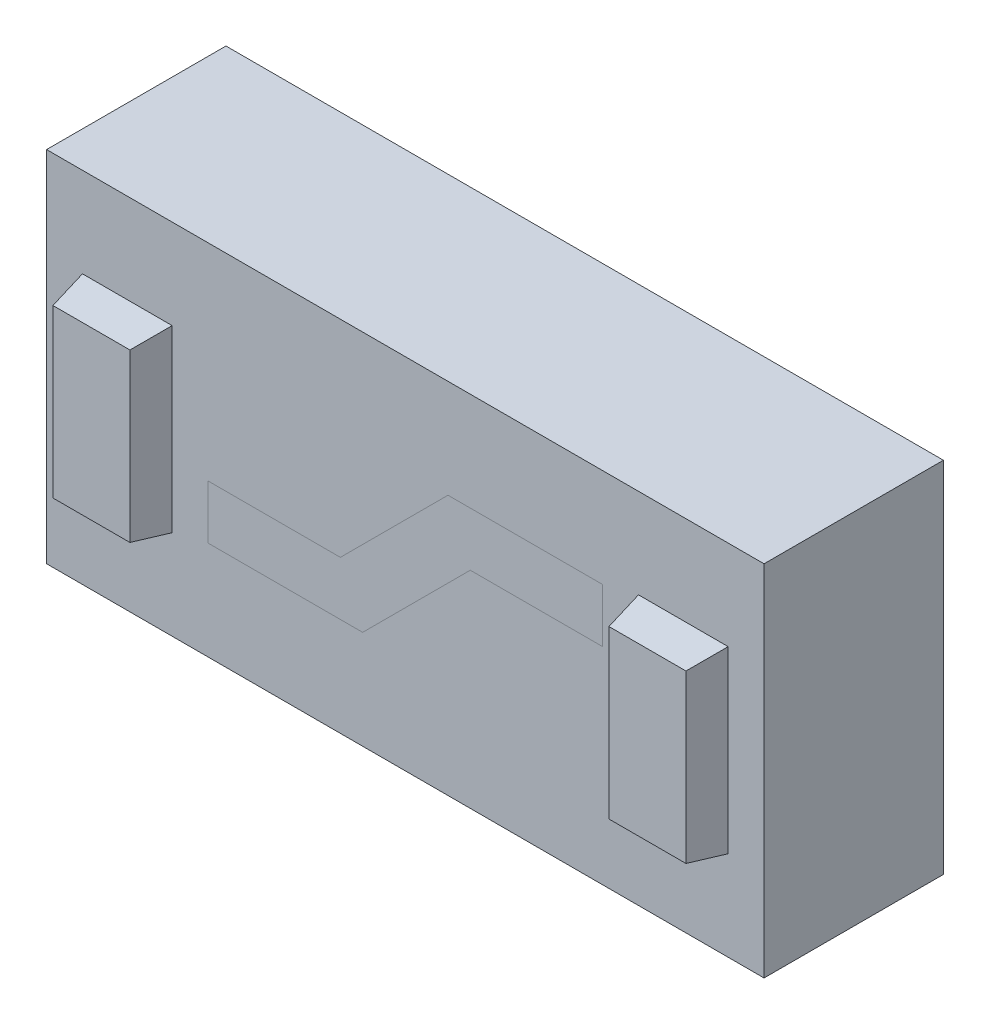
from build123d import *

# Parameters (mm, degrees)
SKETCH1_W                     = 40
SKETCH1_H                     = 20
BOSS_EXTRUDE1_DEPTH           = 10
CUT_EXTRUDE1_DEPTH            = 1.2
BOSS_EXTRUDE2_DEPTH           = 1.2
SKETCH3_W                     = 5
SKETCH3_H                     = 10
BOSS_EXTRUDE3_DEPTH           = 2
BOSS_EXTRUDE3_DRAFT           = 10
BOSS_EXTRUDE3_PROFILE_2_DEPTH = 2
BOSS_EXTRUDE3_PROFILE_2_DRAFT = 10


with BuildPart() as part:
    # Sketch1 → Boss-Extrude1 (new body)
    with BuildSketch(Plane.XY):
        Rectangle(SKETCH1_W, SKETCH1_H)
    extrude(amount=BOSS_EXTRUDE1_DEPTH)

    # Sketch2 → Cut-Extrude1 (cut)
    with BuildSketch(Plane.XY.offset(10)):
        Polygon((-3.621320344, -1.5), (2.378679656, 4.5), (11, 4.5), (11, 1.5), (3.621320344, 1.5), (-2.378679656, -4.5), (-11, -4.5), (-11, -1.5), align=None)
    extrude(amount=-CUT_EXTRUDE1_DEPTH, mode=Mode.SUBTRACT)


with BuildPart() as body_2:
    # Sketch2<2> → Boss-Extrude2 (new body)
    with BuildSketch(Plane.XY.offset(10)):
        Polygon((-3.621320344, -1.5), (2.378679656, 4.5), (11, 4.5), (11, 1.5), (3.621320344, 1.5), (-2.378679656, -4.5), (-11, -4.5), (-11, -1.5), align=None)
    extrude(amount=-BOSS_EXTRUDE2_DEPTH)


with BuildPart() as body_3:
    # Sketch3 → Boss-Extrude3 (with draft: the straight prism first)
    with BuildSketch(Plane.XY.offset(10)):
        with Locations((-15.5, 0)):
            Rectangle(SKETCH3_W, SKETCH3_H)
    extrude(amount=BOSS_EXTRUDE3_DEPTH)
    # Boss-Extrude3: the draft: its side faces are tilted about the plane it starts from
    boss_extrude3_sides = [body_3.faces().sort_by_distance(p)[0] for p in [
        (-15.5, -5, 11),
        (-13, 0, 11),
        (-15.5, 5, 11),
        (-18, 0, 11),
    ]]
    draft(boss_extrude3_sides, Plane.XY.offset(10), BOSS_EXTRUDE3_DRAFT)


with BuildPart() as body_4:
    # Sketch3 → Boss-Extrude3 profile 2 (with draft: the straight prism first)
    with BuildSketch(Plane.XY.offset(10)):
        with Locations((15.5, 0)):
            Rectangle(SKETCH3_W, SKETCH3_H)
    extrude(amount=BOSS_EXTRUDE3_PROFILE_2_DEPTH)
    # Boss-Extrude3 profile 2: the draft: its side faces are tilted about the plane it starts from
    boss_extrude3_profile_2_sides = [body_4.faces().sort_by_distance(p)[0] for p in [
        (15.5, -5, 11),
        (18, 0, 11),
        (15.5, 5, 11),
        (13, 0, 11),
    ]]
    draft(boss_extrude3_profile_2_sides, Plane.XY.offset(10), BOSS_EXTRUDE3_PROFILE_2_DRAFT)


solid = Compound([part.part, body_2.part, body_3.part, body_4.part])
